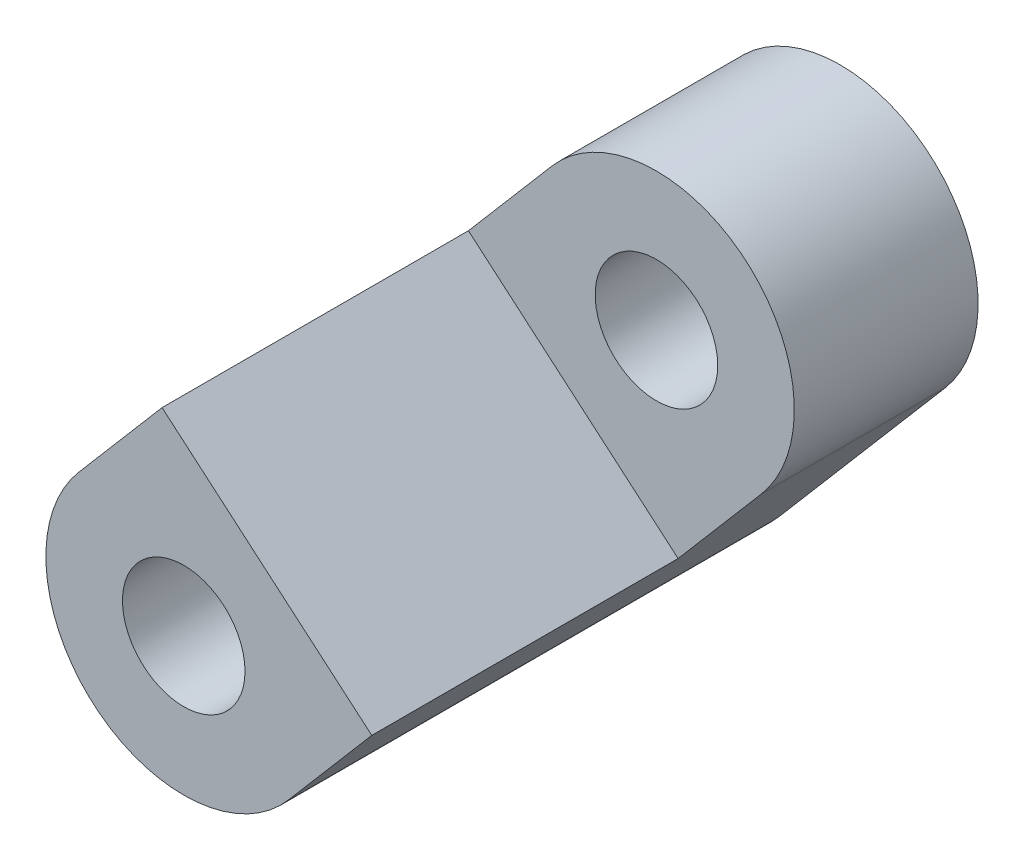
from build123d import *

# Parameters (mm, degrees)
SKETCH3_R           = 1
BOSS_EXTRUDE1_DEPTH = 8
CUT_EXTRUDE1_START  = -5
CUT_EXTRUDE1_DEPTH  = 5


with BuildPart() as part:
    # Sketch3 → Boss-Extrude1 (new body)
    with BuildSketch(Plane(origin=(0, 0, 0), x_dir=(0, 1, 0), z_dir=(0, 0, 1))):
        with BuildLine():
            Line((-9.209045769, 12.846172912), (-12.389045769, 15.561172912))
            ThreePointArc((-12.389045769, 15.561172912), (-15.561172912, 15.310954231), (-15.310954231, 12.138827088))
            Line((-15.310954231, 12.138827088), (-12.130954231, 9.423827088))
            ThreePointArc((-12.130954231, 9.423827088), (-8.958827088, 9.674045769), (-9.209045769, 12.846172912))
        make_face()
        with Locations(Location((-13.85, 13.85, 0), (0, 0, 270))):
            Circle(SKETCH3_R, mode=Mode.SUBTRACT)
        with Locations(Location((-10.67, 11.135, 0), (0, 0, 270))):
            Circle(SKETCH3_R, mode=Mode.SUBTRACT)
    extrude(amount=BOSS_EXTRUDE1_DEPTH)

    # Sketch4 → Cut-Extrude1 (cut)
    with BuildSketch(Plane.XY.offset(8).offset(CUT_EXTRUDE1_START)):
        with BuildLine():
            Line((-12.846172912, -9.209045769), (-14.203672912, -10.799045769))
            Line((-14.203672912, -10.799045769), (-10.781327088, -13.720954231))
            Line((-10.781327088, -13.720954231), (-9.423827088, -12.130954231))
            ThreePointArc((-9.423827088, -12.130954231), (-9.674045769, -8.958827088), (-12.846172912, -9.209045769))
        make_face()
    extrude(amount=CUT_EXTRUDE1_DEPTH, mode=Mode.SUBTRACT)


solid = part.part
